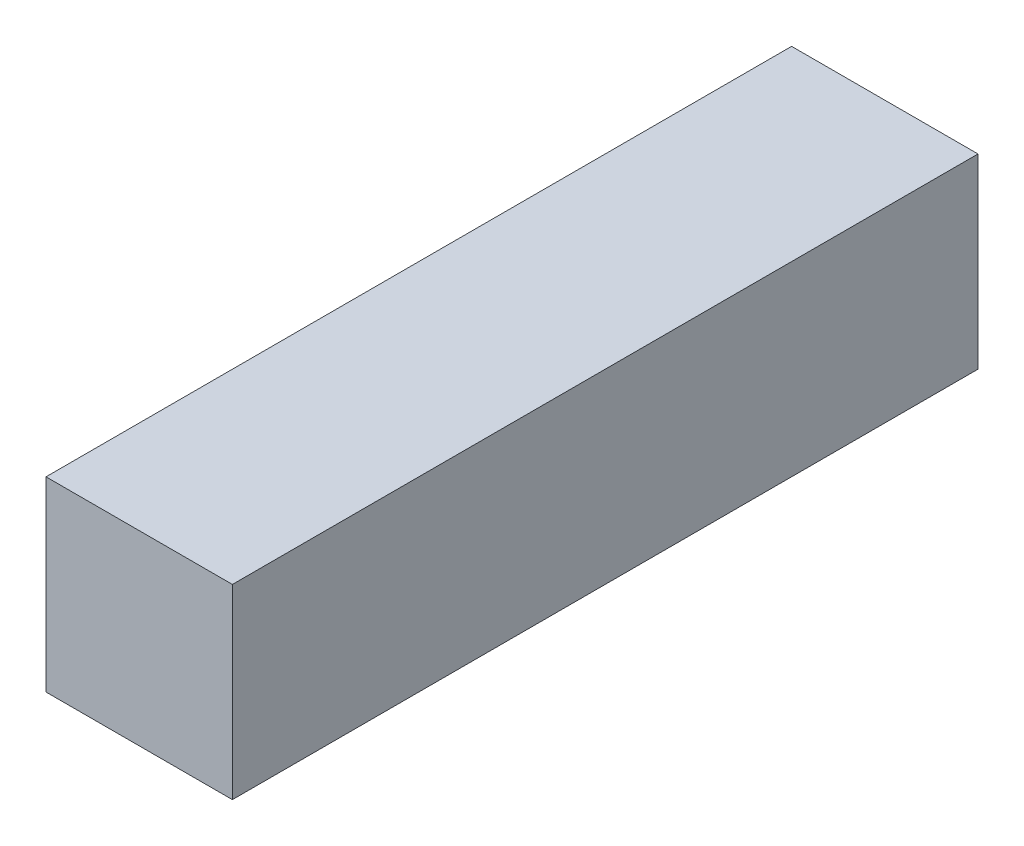
from build123d import *

# Parameters (mm, degrees)
SKETCH1_W           = 3
SKETCH1_H           = 3
BOSS_EXTRUDE1_DEPTH = 12


with BuildPart() as part:
    # Sketch1 → Boss-Extrude1 (new body)
    with BuildSketch(Plane.XY):
        with Locations((-3.25, -0.25)):
            Rectangle(SKETCH1_W, SKETCH1_H)
    extrude(amount=BOSS_EXTRUDE1_DEPTH)


solid = part.part
